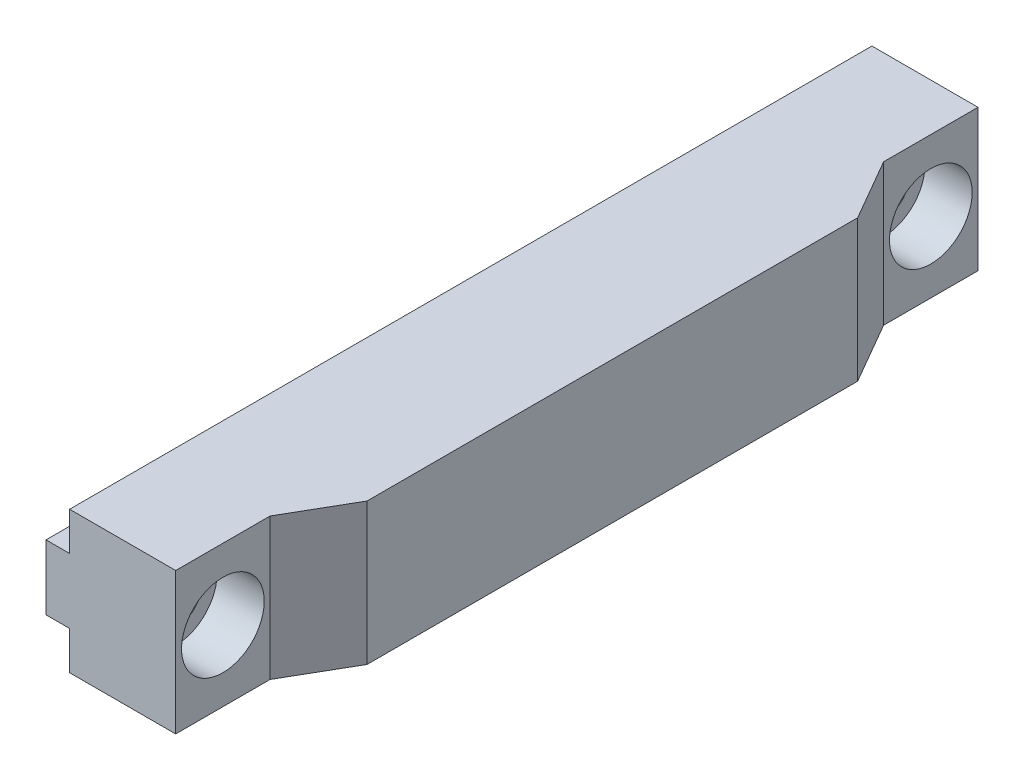
from build123d import *

# Parameters (mm, degrees)
BOSS_EXTRUDE1_DEPTH = 9.525
BOSS_EXTRUDE2_START = -12.7
SKETCH2_W           = 107.95
SKETCH2_H           = 8.7376
BOSS_EXTRUDE2_DEPTH = 3.175
CUT_EXTRUDE2_START  = 4.7498
SKETCH3_R           = 3.5687
CUT_EXTRUDE2_DEPTH  = 22.225
CUT_EXTRUDE4_START  = 4.7498
SKETCH4_R           = 5.5626
CUT_EXTRUDE4_DEPTH  = 6.35


with BuildPart() as part:
    # Sketch1 → Boss-Extrude1 (new, symmetric)
    with BuildSketch(Plane(origin=(0, 0, 0), x_dir=(1, 0, 0), z_dir=(0, 1, 0))):
        Polygon((-9.525, -53.975), (-9.525, 53.975), (4.7498, 53.975), (4.7498, 41.275), (9.525, 33.004110984), (9.525, -33.004110984), (4.7498, -41.275), (4.7498, -53.975), align=None)
    extrude(amount=BOSS_EXTRUDE1_DEPTH, both=True)

    # Sketch2 → Boss-Extrude2 (add)
    with BuildSketch(Plane(origin=(0, 0, 0), x_dir=(0, 0, -1), z_dir=(1, 0, 0)).offset(BOSS_EXTRUDE2_START)):
        Rectangle(SKETCH2_W, SKETCH2_H)
    extrude(amount=BOSS_EXTRUDE2_DEPTH)

    # Sketch3 → Cut-Extrude2 (cut)
    with BuildSketch(Plane(origin=(0, 0, 0), x_dir=(0, 0, -1), z_dir=(1, 0, 0)).offset(CUT_EXTRUDE2_START)):
        with Locations((-47.625, 0)):
            Circle(SKETCH3_R)
        with Locations((47.625, 0)):
            Circle(SKETCH3_R)
    extrude(amount=-CUT_EXTRUDE2_DEPTH, mode=Mode.SUBTRACT)

    # Sketch4 → Cut-Extrude4 (cut)
    with BuildSketch(Plane(origin=(0, 0, 0), x_dir=(0, 0, -1), z_dir=(1, 0, 0)).offset(CUT_EXTRUDE4_START)):
        with Locations((-47.625, 0)):
            Circle(SKETCH4_R)
        with Locations((47.625, 0)):
            Circle(SKETCH4_R)
    extrude(amount=-CUT_EXTRUDE4_DEPTH, mode=Mode.SUBTRACT)


solid = part.part
